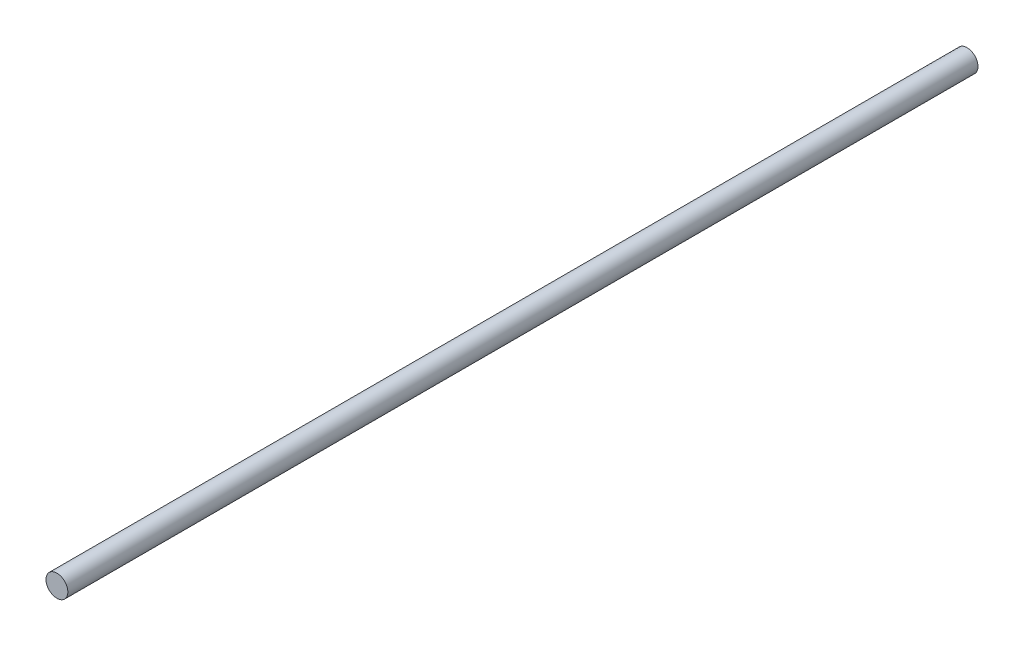
from build123d import *

# Parameters (mm, degrees)
SKETCH1_R           = 6
BOSS_EXTRUDE1_DEPTH = 250


with BuildPart() as part:
    # Sketch1 → Boss-Extrude1 (new, symmetric)
    with BuildSketch(Plane.XY):
        Circle(SKETCH1_R)
    extrude(amount=BOSS_EXTRUDE1_DEPTH, both=True)


solid = part.part
